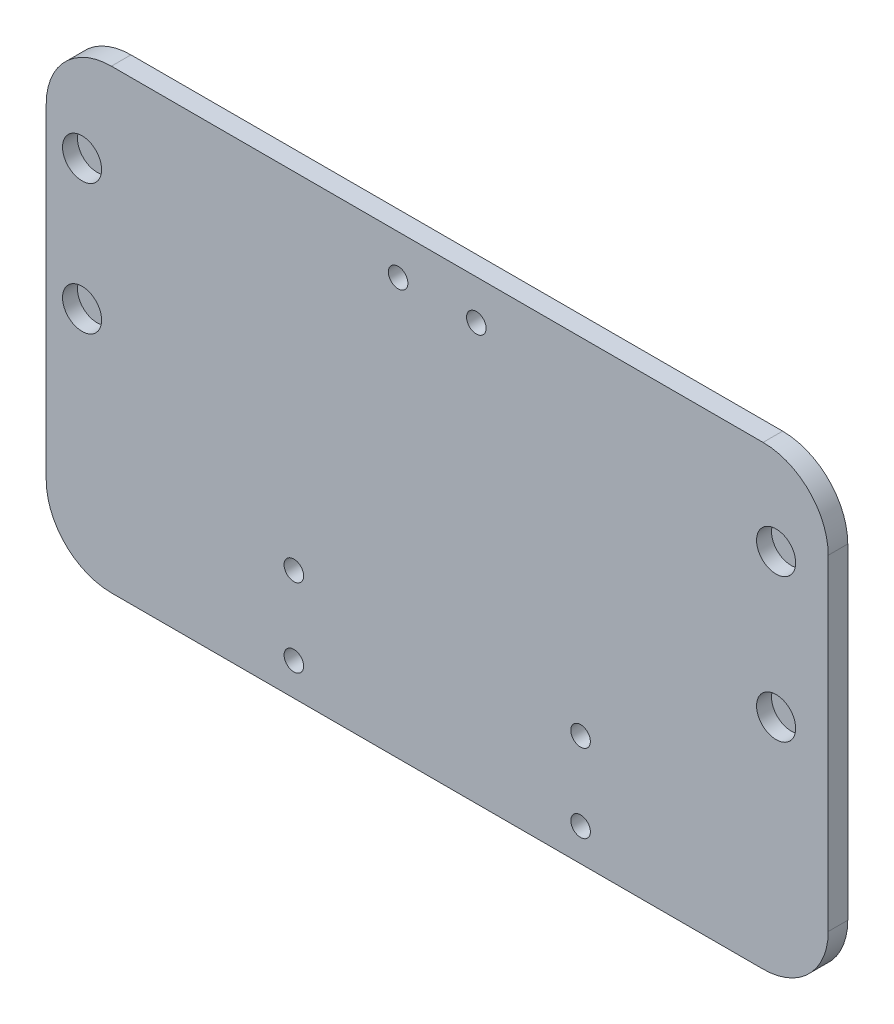
from build123d import *

# Parameters (mm, degrees)
BOSS_EXTRUDE1_DEPTH = 3
SKETCH2_R           = 1.5
CUT_EXTRUDE1_DEPTH  = 115.861021763
SKETCH3_R           = 3
CUT_EXTRUDE2_DEPTH  = 2.3


with BuildPart() as part:
    # Sketch1 → Boss-Extrude1 (new body)
    with BuildSketch(Plane.XY):
        with BuildLine():
            Line((-98.454935622, 37.703862661), (1.545064378, 37.703862661))
            ThreePointArc((1.545064378, 37.703862661), (8.61613219, 34.774930473), (11.545064378, 27.703862661))
            Line((11.545064378, 27.703862661), (11.545064378, -22.296137339))
            ThreePointArc((11.545064378, -22.296137339), (8.61613219, -29.367205151), (1.545064378, -32.296137339))
            Line((1.545064378, -32.296137339), (-98.454935622, -32.296137339))
            ThreePointArc((-98.454935622, -32.296137339), (-105.526003434, -29.367205151), (-108.454935622, -22.296137339))
            Line((-108.454935622, -22.296137339), (-108.454935622, 27.703862661))
            ThreePointArc((-108.454935622, 27.703862661), (-105.526003434, 34.774930473), (-98.454935622, 37.703862661))
        make_face()
    extrude(amount=BOSS_EXTRUDE1_DEPTH)

    # Sketch2 → Cut-Extrude1 (cut, through all)
    with BuildSketch(Plane.XY.offset(3)):
        with Locations((-54.454935622, 31.60657407)):
            Circle(SKETCH2_R)
        with Locations((-42.454935622, 31.60657407)):
            Circle(SKETCH2_R)
        with Locations((-70.454935622, -15.296137339)):
            Circle(SKETCH2_R)
        with Locations((-70.454935622, -27.296137339)):
            Circle(SKETCH2_R)
        with Locations((-26.454935622, -15.296137339)):
            Circle(SKETCH2_R)
        with Locations((-26.454935622, -27.296137339)):
            Circle(SKETCH2_R)
    extrude(amount=-CUT_EXTRUDE1_DEPTH, mode=Mode.SUBTRACT)

    # Sketch3 → Cut-Extrude2 (cut)
    with BuildSketch(Plane.XY.offset(3)):
        with Locations((-102.954935622, 23.203862661)):
            Circle(SKETCH3_R)
        with Locations((-102.954935622, 3.203862661)):
            Circle(SKETCH3_R)
        with Locations((3.545064378, 24.203862661)):
            Circle(SKETCH3_R)
        with Locations((3.545064378, 2.203862661)):
            Circle(SKETCH3_R)
    extrude(amount=-CUT_EXTRUDE2_DEPTH, mode=Mode.SUBTRACT)


solid = part.part
